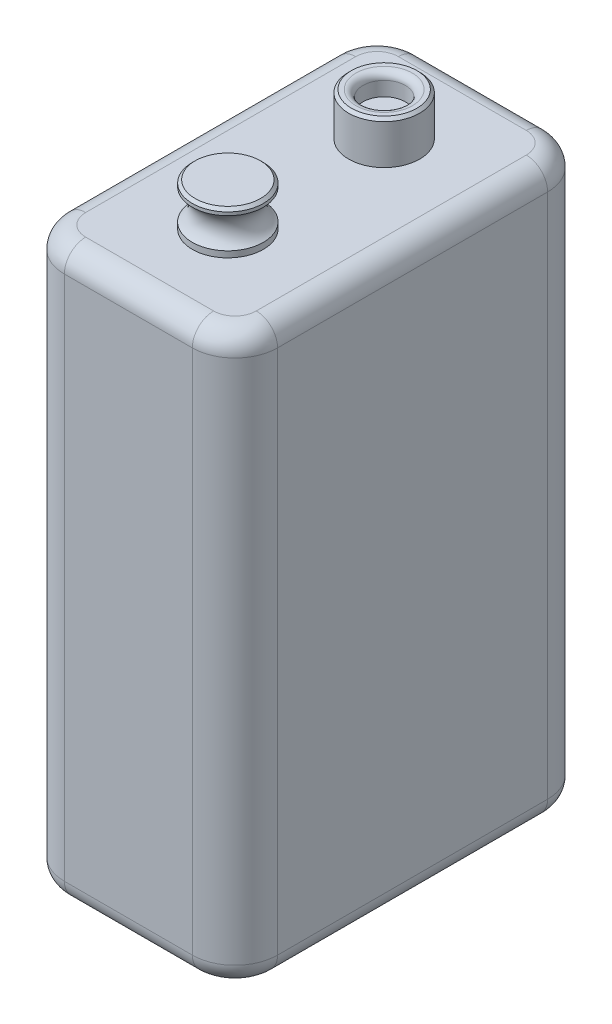
from build123d import *

# Parameters (mm, degrees)
CROQUIS1_W              = 15
CROQUIS1_H              = 25
SALIENTE_EXTRUIR1_DEPTH = 40
REDONDEO1_R             = 3
REDONDEO2_R             = 1.5
REDONDEO3_R             = 1.5
CROQUIS2_R              = 2.5
SALIENTE_EXTRUIR2_DEPTH = 3
CROQUIS3_R              = 1.487403204
CORTAR_EXTRUIR1_DEPTH   = 1.5
REDONDEO4_R             = 0.5
CHAFL_N1_SIZE           = 0.2
CROQUIS4_R              = 1.299235838
CHAFL_N2_SIZE           = 0.2


with BuildPart() as part:
    # Croquis1 → Saliente-Extruir1 (new body)
    with BuildSketch(Plane(origin=(0, 0, 0), x_dir=(1, 0, 0), z_dir=(0, 1, 0))):
        Rectangle(CROQUIS1_W, CROQUIS1_H)
    extrude(amount=SALIENTE_EXTRUIR1_DEPTH)

    # Redondeo1
    redondeo1_edges = [part.edges().sort_by_distance(p)[0] for p in [
        (7.5, 20, 12.5),
        (-7.5, 20, 12.5),
        (-7.5, 20, -12.5),
        (7.5, 20, -12.5),
    ]]
    fillet(redondeo1_edges, radius=REDONDEO1_R)

    # Redondeo2
    redondeo2_edges = [part.edges().sort_by_distance(p)[0] for p in [
        (-7.5, 0, 0),
        (7.5, 0, 0),
        (0, 0, 12.5),
        (0, 0, -12.5),
        (6.621320344, 0, 11.621320344),
        (-6.621320344, 0, 11.621320344),
        (6.621320344, 0, -11.621320344),
        (-6.621320344, 0, -11.621320344),
    ]]
    fillet(redondeo2_edges, radius=REDONDEO2_R)

    # Redondeo3
    redondeo3_edges = [part.edges().sort_by_distance(p)[0] for p in [
        (-7.5, 40, 0),
        (0, 40, -12.5),
        (7.5, 40, 0),
        (0, 40, 12.5),
        (6.621320344, 40, 11.621320344),
        (-6.621320344, 40, 11.621320344),
        (6.621320344, 40, -11.621320344),
        (-6.621320344, 40, -11.621320344),
    ]]
    fillet(redondeo3_edges, radius=REDONDEO3_R)

    # Croquis2 → Saliente-Extruir2 (add)
    with BuildSketch(Plane(origin=(0, 40, 0), x_dir=(1, 0, 0), z_dir=(0, 1, 0))):
        with Locations(Location((0, 5.5, 0), (0, 0, 270))):
            Circle(CROQUIS2_R)
        with Locations(Location((0, -5.5, 0), (0, 0, 90))):
            Circle(CROQUIS2_R)
    extrude(amount=SALIENTE_EXTRUIR2_DEPTH)

    # Croquis3 → Cortar-Extruir1 (cut)
    with BuildSketch(Plane(origin=(0, 43, 0), x_dir=(1, 0, 0), z_dir=(0, 1, 0))):
        with Locations(Location((0, 5.5, 0), (0, 0, 270))):
            Circle(CROQUIS3_R)
    extrude(amount=-CORTAR_EXTRUIR1_DEPTH, mode=Mode.SUBTRACT)

    # Redondeo4
    redondeo4_edges = [part.edges().sort_by_distance(p)[0] for p in [
        (0, 43, -6.987403204),
    ]]
    fillet(redondeo4_edges, radius=REDONDEO4_R)

    # Chaflán1
    chafl_n1_edges = [part.edges().sort_by_distance(p)[0] for p in [
        (0, 43, -8),
    ]]
    chamfer(chafl_n1_edges, length=CHAFL_N1_SIZE)

    # Croquis4 → Cortar-Revolución1 (revolve, cut)
    with BuildSketch(Plane(origin=(0, 0, 0), x_dir=(0, 0, -1), z_dir=(1, 0, 0))):
        with Locations((-2.260920396, 41.5)):
            Circle(CROQUIS4_R)
    revolve(axis=Axis((0, 43, 5.5), (0, -1, 0)), mode=Mode.SUBTRACT)

    # Chaflán2
    chafl_n2_edges = [part.edges().sort_by_distance(p)[0] for p in [
        (0, 43, 8),
    ]]
    chamfer(chafl_n2_edges, length=CHAFL_N2_SIZE)


solid = part.part
